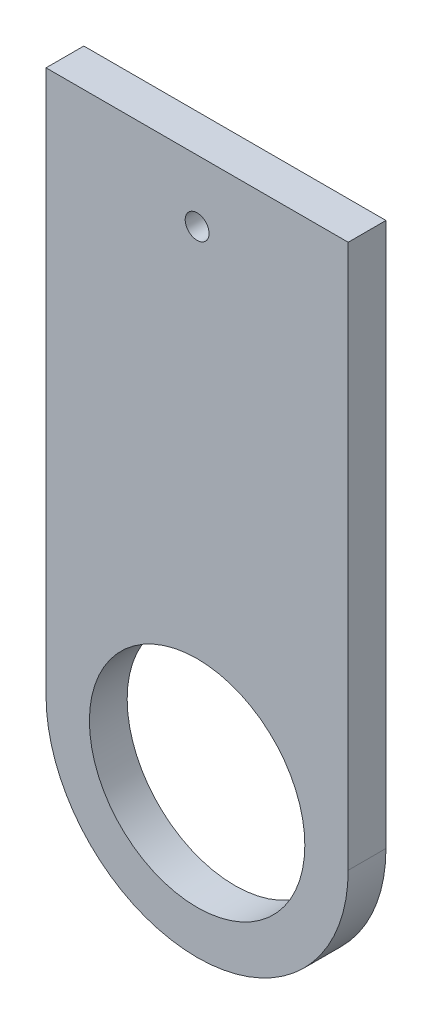
from build123d import *

# Parameters (mm, degrees)
SKETCH1_R           = 1.58
SKETCH1_R_2         = 14.26
BOSS_EXTRUDE1_DEPTH = 5


with BuildPart() as part:
    # Sketch1 → Boss-Extrude1 (new body)
    with BuildSketch(Plane.XY):
        with BuildLine():
            Line((-20, -76.707766284), (-20, -58.504148974))
            Line((-20, -58.504148974), (-20, -4.707766284))
            Line((-20, -4.707766284), (20, -4.707766284))
            Line((20, -4.707766284), (20, -76.707766284))
            ThreePointArc((20, -76.707766284), (0, -96.707766284), (-20, -76.707766284))
        make_face()
        with Locations((0, -12.911655735)):
            Circle(SKETCH1_R, mode=Mode.SUBTRACT)
        with Locations((0, -76.707766284)):
            Circle(SKETCH1_R_2, mode=Mode.SUBTRACT)
    extrude(amount=BOSS_EXTRUDE1_DEPTH)


solid = part.part
